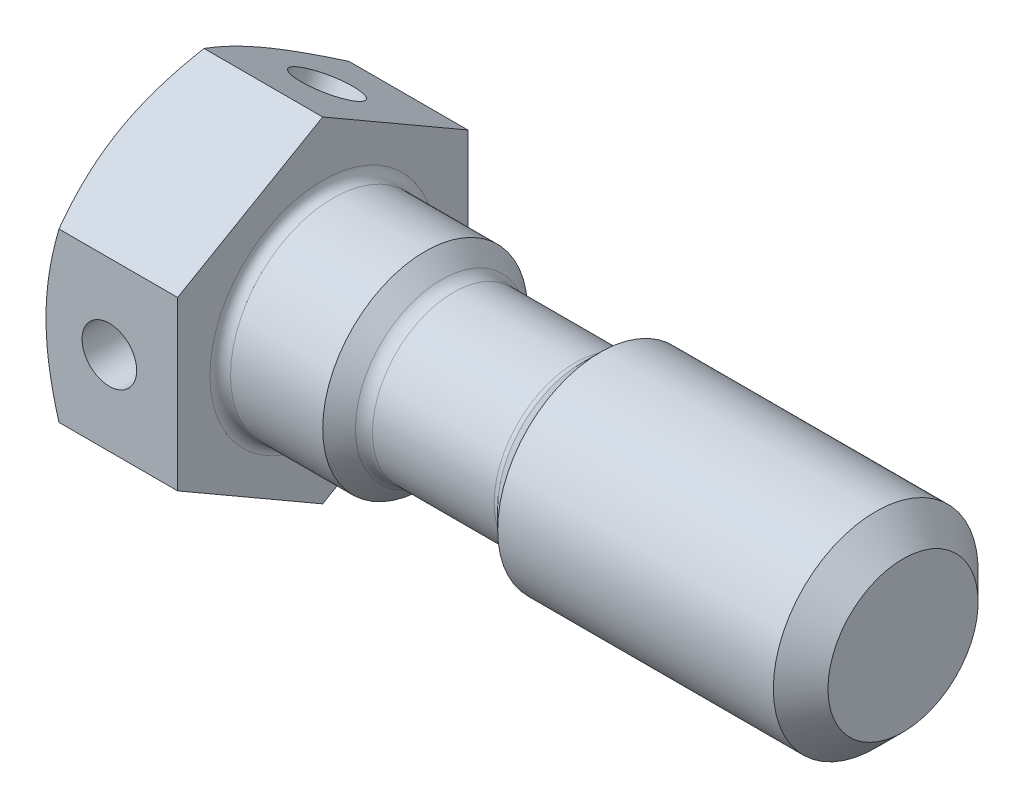
from build123d import *

# Parameters (mm, degrees)
EXTRUDE_1_DEPTH     = 8
SKETCH_3_OUTSIDE_W  = 184.626
SKETCH_3_OUTSIDE_H  = 187.256
SKETCH_3_OUTSIDE_R  = 8
CUT_EXTRUDE_1_DEPTH = 44.961157097
CUT_EXTRUDE_1_DRAFT = -60
FILLET_1_R          = 0.6
SKETCH_4_R          = 1.6
CUT_EXTRUDE_2_DEPTH = 40.259818305
SKETCH_5_R          = 1.75
CUT_EXTRUDE_3_DEPTH = 41.169432823


with BuildPart() as part:
    # Эскиз1 → Повернуть1 (revolve)
    with BuildSketch(Plane.XY, mode=Mode.PRIVATE) as revolve_1_sk:
        with BuildLine():
            Line((0, 0), (0, 6))
            Line((0, 6), (6, 6))
            Line((6, 6), (6.957106781, 5.042893219))
            ThreePointArc((6.957106781, 5.042893219), (7.28153013, 4.826120467), (7.664213562, 4.75))
            Line((7.664213562, 4.75), (14.792893219, 4.75))
            ThreePointArc((14.792893219, 4.75), (14.984234935, 4.788060234), (15.146446609, 4.896446609))
            Line((15.146446609, 4.896446609), (16.25, 6))
            Line((16.25, 6), (32.4, 6))
            Line((32.4, 6), (34, 4.4))
            Line((34, 4.4), (34, 0))
            Line((34, 0), (0, 0))
        make_face()
    revolve(revolve_1_sk.sketch.rotate(Axis((0, 0, 0), (1, 0, 0)), 90), axis=Axis((0, 0, 0), (1, 0, 0)))

    # Эскиз2 → Бобышка-Вытянуть1 (add)
    with BuildSketch(Plane.ZY):
        Polygon((0, -9.814954576), (8.5, -4.907477288), (8.5, 4.907477288), (0, 9.814954576), (-8.5, 4.907477288), (-8.5, -4.907477288), align=None)
    extrude(amount=EXTRUDE_1_DEPTH)


with BuildPart() as cut_extrude_1_tool:
    # Эскиз3 outside → Вырез-Вытянуть1 (with draft: the straight prism first)
    with BuildSketch(Plane.ZY.offset(8)):
        Rectangle(SKETCH_3_OUTSIDE_W, SKETCH_3_OUTSIDE_H)
        Circle(SKETCH_3_OUTSIDE_R, mode=Mode.SUBTRACT)
    extrude(amount=-CUT_EXTRUDE_1_DEPTH)
    # Вырез-Вытянуть1: the draft: its side faces are tilted about the plane it starts from
    cut_extrude_1_sides = [cut_extrude_1_tool.faces().sort_by_distance(p)[0] for p in [
        (14.480578549, -93.628, 0),
        (14.480578549, 0, 92.313),
        (14.480578549, 93.628, 0),
        (14.480578549, 0, -92.313),
        (14.480578549, 0, -8),
    ]]
    draft(cut_extrude_1_sides, Plane.ZY.offset(8), CUT_EXTRUDE_1_DRAFT)


with BuildPart() as part_1:
    add(part.part)

    # Вырез-Вытянуть1: cut by cut_extrude_1_tool
    add(cut_extrude_1_tool.part, mode=Mode.SUBTRACT)

    # Скругление1
    fillet_1_edges = [part_1.edges().sort_by_distance(p)[0] for p in [
        (0, 0, -6),
    ]]
    fillet(fillet_1_edges, radius=FILLET_1_R)

    # Эскиз4 → Вырез-Вытянуть2 (cut, through all)
    with BuildSketch(Plane.XY.offset(8.5)):
        with Locations((-4, 0)):
            Circle(SKETCH_4_R)
    extrude(amount=-CUT_EXTRUDE_2_DEPTH, mode=Mode.SUBTRACT)

    # Эскиз5 → Вырез-Вытянуть3 (cut, through all)
    with BuildSketch(Plane(origin=(0, -7.361215932, 4.25), x_dir=(1, 0, 0), z_dir=(0, -0.8660254037844384, 0.5000000000000003))):
        with Locations(Location((-4, 0, 0), (0, 0, 270))):
            Circle(SKETCH_5_R)
    extrude(amount=-CUT_EXTRUDE_3_DEPTH, mode=Mode.SUBTRACT)


solid = part_1.part
